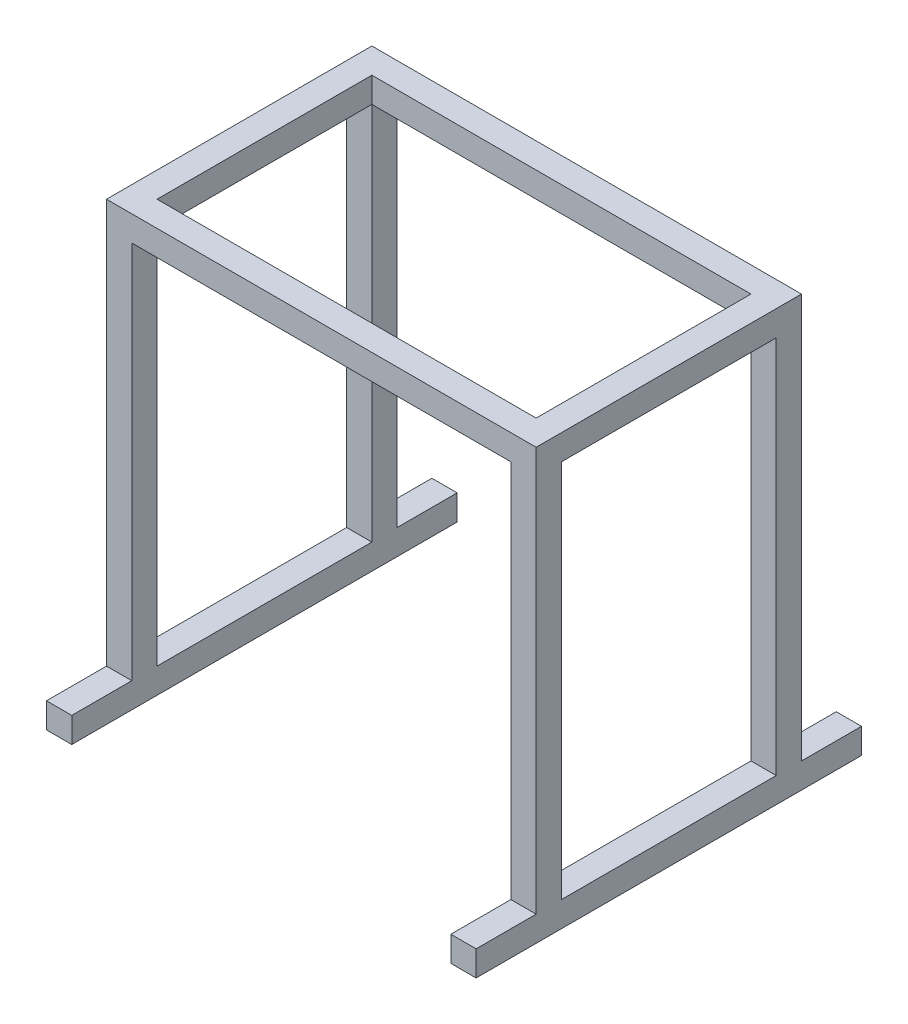
from build123d import *

# Parameters (mm, degrees)
SKETCH1_W                = 340
SKETCH1_H                = 210
BOSS_EXTRUDE1_DEPTH      = 320
SKETCH2_W                = 300
SKETCH2_H                = 170
CUT_EXTRUDE1_DEPTH       = 378.259857393
SKETCH3_W                = 300
SKETCH3_H                = 600
CUT_EXTRUDE2_DEPTH       = 419.807831827
SKETCH4_W                = 170
SKETCH4_H                = 600
CUT_EXTRUDE3_DEPTH       = 479.565564996
BOSS_EXTRUDE2_DEPTH      = 152.5
BOSS_EXTRUDE2_DEPTH_BACK = 152.5
SKETCH5_W                = 20
SKETCH5_H                = 20
SKETCH5_W_2              = 40
SKETCH6_W                = 20
SKETCH6_H                = 305
CUT_EXTRUDE4_DEPTH       = 403.189321091


with BuildPart() as part:
    # Sketch1 → Boss-Extrude1 (new body)
    with BuildSketch(Plane(origin=(0, 0, 0), x_dir=(1, 0, 0), z_dir=(0, 1, 0))):
        Rectangle(SKETCH1_W, SKETCH1_H)
    extrude(amount=-BOSS_EXTRUDE1_DEPTH)

    # Sketch2 → Cut-Extrude1 (cut, through all)
    with BuildSketch(Plane(origin=(0, 0, 0), x_dir=(1, 0, 0), z_dir=(0, 1, 0))):
        Rectangle(SKETCH2_W, SKETCH2_H)
    extrude(amount=-CUT_EXTRUDE1_DEPTH, mode=Mode.SUBTRACT)

    # Sketch3 → Cut-Extrude2 (cut, through all)
    with BuildSketch(Plane.XY.offset(105)):
        with Locations((0, -320)):
            Rectangle(SKETCH3_W, SKETCH3_H)
    extrude(amount=-CUT_EXTRUDE2_DEPTH, mode=Mode.SUBTRACT)

    # Sketch4 → Cut-Extrude3 (cut, through all)
    with BuildSketch(Plane(origin=(170, 0, 0), x_dir=(0, 0, -1), z_dir=(1, 0, 0))):
        with Locations((0, -320)):
            Rectangle(SKETCH4_W, SKETCH4_H)
    extrude(amount=-CUT_EXTRUDE3_DEPTH, mode=Mode.SUBTRACT)

    # Sketch5 → Boss-Extrude2 (add, two sides: drawn at the far end of the back side and taken through both)
    with BuildSketch(Plane.XY.offset(-BOSS_EXTRUDE2_DEPTH_BACK)):
        with Locations((-160, -330)):
            Rectangle(SKETCH5_W, SKETCH5_H)
        with Locations((170, -330)):
            Rectangle(SKETCH5_W_2, SKETCH5_H)
    extrude(amount=BOSS_EXTRUDE2_DEPTH + BOSS_EXTRUDE2_DEPTH_BACK)

    # Sketch6 → Cut-Extrude4 (cut, through all)
    with BuildSketch(Plane(origin=(0, -320, 0), x_dir=(1, 0, 0), z_dir=(0, 1, 0))):
        with Locations((180, 0)):
            Rectangle(SKETCH6_W, SKETCH6_H)
    extrude(amount=-CUT_EXTRUDE4_DEPTH, mode=Mode.SUBTRACT)


solid = part.part
